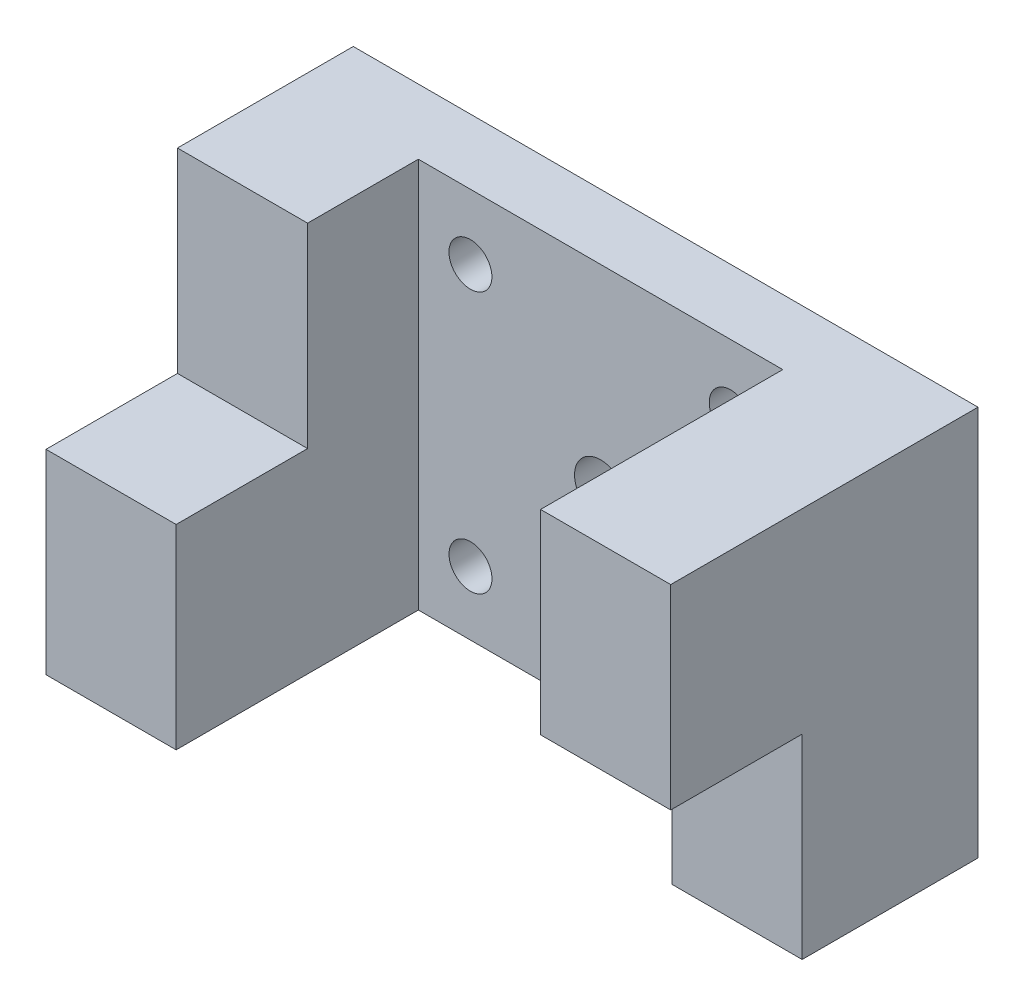
from build123d import *

# Parameters (mm, degrees)
SKETCH1_W           = 48
SKETCH1_H           = 30
SKETCH1_R           = 1.65
SKETCH1_R_2         = 2
BOSS_EXTRUDE1_DEPTH = 5
SKETCH2_W           = 10
SKETCH2_H           = 15
BOSS_EXTRUDE2_DEPTH = 18.61
SKETCH2_3_W         = 10
SKETCH2_3_H         = 15
BOSS_EXTRUDE3_DEPTH = 8.51


with BuildPart() as part:
    # Sketch1 → Boss-Extrude1 (new body)
    with BuildSketch(Plane.XY):
        Rectangle(SKETCH1_W, SKETCH1_H)
        with Locations((-10, 10)):
            Circle(SKETCH1_R, mode=Mode.SUBTRACT)
        with Locations((10, 10)):
            Circle(SKETCH1_R, mode=Mode.SUBTRACT)
        with Locations((10, -10)):
            Circle(SKETCH1_R, mode=Mode.SUBTRACT)
        with Locations((-9.995165444, -10.096450463)):
            Circle(SKETCH1_R, mode=Mode.SUBTRACT)
        Circle(SKETCH1_R_2, mode=Mode.SUBTRACT)
    extrude(amount=BOSS_EXTRUDE1_DEPTH)

    # Sketch2 → Boss-Extrude2 (add)
    with BuildSketch(Plane.XY.offset(5)):
        with Locations((-19, -7.5)):
            Rectangle(SKETCH2_W, SKETCH2_H)
        with Locations((19, 7.5)):
            Rectangle(SKETCH2_W, SKETCH2_H)
    extrude(amount=BOSS_EXTRUDE2_DEPTH)

    # Sketch2<3> → Boss-Extrude3 (add)
    with BuildSketch(Plane.XY.offset(5)):
        with Locations((-19, 7.5)):
            Rectangle(SKETCH2_3_W, SKETCH2_3_H)
        with Locations((19, -7.5)):
            Rectangle(SKETCH2_3_W, SKETCH2_3_H)
    extrude(amount=BOSS_EXTRUDE3_DEPTH)


solid = part.part
